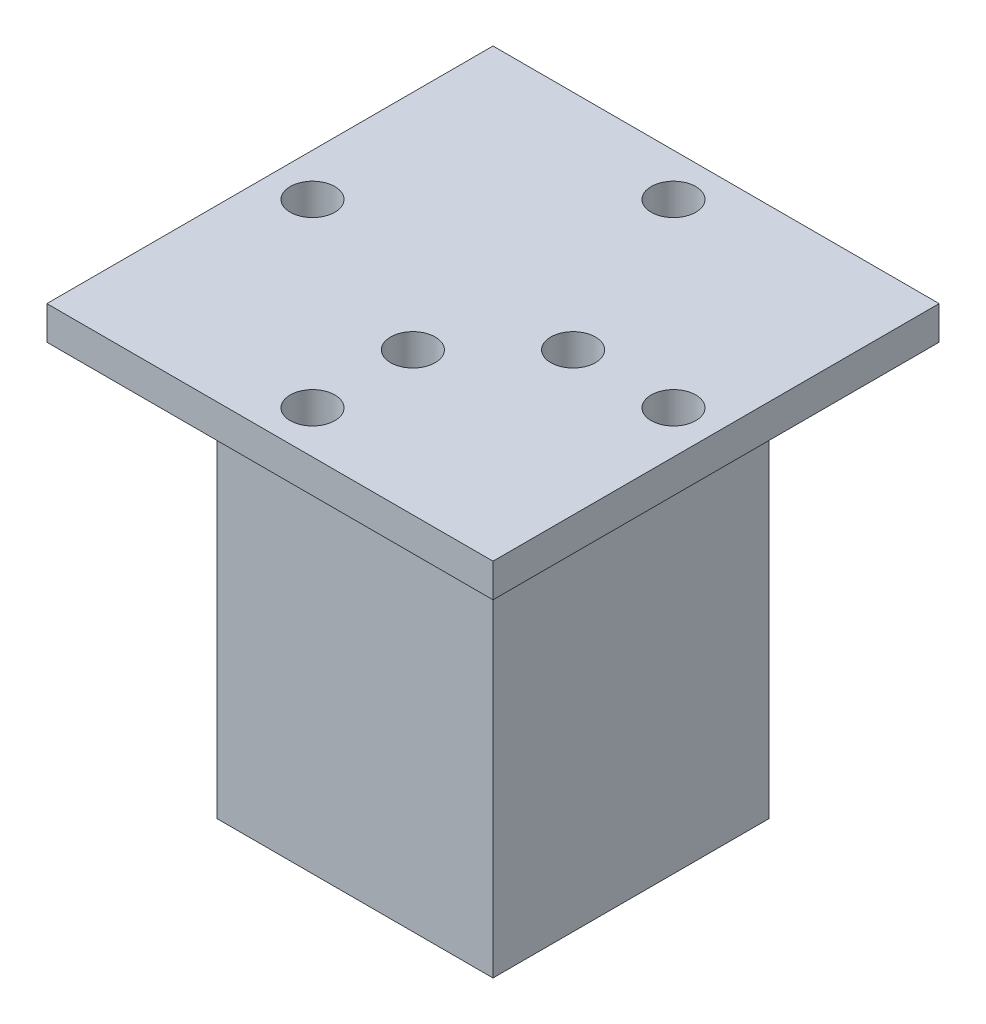
from build123d import *

# Parameters (mm, degrees)
SKETCH1_W                                      = 193.929
SKETCH1_H                                      = 117.602
BOSS_EXTRUDE1_DEPTH                            = 2.667
CUT_EXTRUDE1_DEPTH                             = 0.254
BOSS_EXTRUDE2_DEPTH                            = 0.254
BOSS_EXTRUDE3_DEPTH                            = 1.6002
BOSS_EXTRUDE4_DEPTH                            = 1.6002
BOSS_EXTRUDE5_DEPTH                            = 1.6002
BOSS_EXTRUDE6_DEPTH                            = 1.6002
BOSS_EXTRUDE7_DEPTH                            = 1.6002
SKETCH9_W                                      = 3.683
SKETCH9_H                                      = 3.175
SKETCH10_W                                     = 3.683
SKETCH10_H                                     = 3.175
SKETCH11_W                                     = 3.683
SKETCH11_H                                     = 3.175
SKETCH12_W                                     = 3.683
SKETCH12_H                                     = 3.175
CSK_FOR_M3_FLAT_HEAD_MACHINE_SCREW1_AT_2_COUNT = 2
CSK_FOR_M3_FLAT_HEAD_MACHINE_SCREW1_AT_2_PITCH = 202.702821766
CSK_FOR_M3_FLAT_HEAD_MACHINE_SCREW1_AT_3_COUNT = 2
CSK_FOR_M3_FLAT_HEAD_MACHINE_SCREW1_AT_3_PITCH = 176.276
CSK_FOR_M3_FLAT_HEAD_MACHINE_SCREW1_AT_4_COUNT = 2
CSK_FOR_M3_FLAT_HEAD_MACHINE_SCREW1_AT_4_PITCH = 100.076
FILLET1_R                                      = 5.1562
FILLET2_R                                      = 1.5748
FILLET3_R                                      = 3.9624
FILLET4_R                                      = 4.7498
SKETCH16_W                                     = 24.727732192
SKETCH16_H                                     = 24.727732192
BOSS_EXTRUDE8_DEPTH                            = 40
SKETCH18_W                                     = 40
SKETCH18_H                                     = 40
SKETCH18_W_2                                   = 24.727732192
SKETCH18_H_2                                   = 24.727732192
BOSS_EXTRUDE9_DEPTH                            = 3
CUT_EXTRUDE2_DEPTH                             = 40
CUT_EXTRUDE2_DEPTH_BACK                        = 40
SKETCH17_R                                     = 2
SKETCH19_R                                     = 2
CUT_EXTRUDE3_DEPTH                             = 10
SKETCH20_W                                     = 226.645594452
SKETCH20_H                                     = 139.264160446
SKETCH20_W_2                                   = 98.304113256
SKETCH20_H_2                                   = 70.390599616
CUT_EXTRUDE4_DEPTH                             = 121.248375711
SKETCH21_W                                     = 98.304113256
SKETCH21_H                                     = 2.667
CUT_EXTRUDE5_DEPTH                             = 100.458365049
SKETCH23_R                                     = 2
CUT_EXTRUDE6_DEPTH                             = 49.989794856


with BuildPart() as part:
    # Sketch1 → Boss-Extrude1 (new body)
    with BuildSketch(Plane.XZ.offset(2.667)):
        Rectangle(SKETCH1_W, SKETCH1_H)
    extrude(amount=-BOSS_EXTRUDE1_DEPTH)

    # Sketch2 → Cut-Extrude1 (cut)
    with BuildSketch(Plane.XZ.offset(2.667)):
        Polygon((-74.4728, 55.3085), (-93.472, 36.2712), (-93.472, -36.2712), (-74.4728, -55.3085), (74.4728, -55.3085), (93.472, -36.2712), (93.472, 36.2712), (74.4728, 55.3085), align=None)
    extrude(amount=-CUT_EXTRUDE1_DEPTH, mode=Mode.SUBTRACT)

    # Sketch3 → Boss-Extrude2 (add)
    with BuildSketch(Plane.XZ.offset(2.413)):
        Polygon((92.6846, 35.945510163), (92.6846, -35.945510163), (74.146186127, -54.5211), (-74.146186127, -54.5211), (-92.6846, -35.945510163), (-92.6846, 35.945510163), (-74.146186127, 54.5211), (74.146186127, 54.5211), align=None)
    extrude(amount=BOSS_EXTRUDE2_DEPTH)

    # Sketch4 → Boss-Extrude3 (add)
    with BuildSketch(Plane(origin=(0, 0, 0), x_dir=(-1, 0, 0), z_dir=(0, 1, 0))):
        with BuildLine():
            Line((92.6211, -49.3395), (92.6211, 49.3395))
            ThreePointArc((92.6211, 49.3395), (93.4212, 50.1396), (94.2213, 49.3395))
            Line((94.2213, 49.3395), (94.2213, -49.3395))
            ThreePointArc((94.2213, -49.3395), (93.4212, -50.1396), (92.6211, -49.3395))
        make_face()
    extrude(amount=BOSS_EXTRUDE3_DEPTH)

    # Sketch5 → Boss-Extrude4 (add)
    with BuildSketch(Plane(origin=(0, 0, 0), x_dir=(-1, 0, 0), z_dir=(0, 1, 0))):
        with BuildLine():
            Line((-94.2213, -49.3395), (-94.2213, 49.3395))
            ThreePointArc((-94.2213, 49.3395), (-93.4212, 50.1396), (-92.6211, 49.3395))
            Line((-92.6211, 49.3395), (-92.6211, -49.3395))
            ThreePointArc((-92.6211, -49.3395), (-93.4212, -50.1396), (-94.2213, -49.3395))
        make_face()
    extrude(amount=BOSS_EXTRUDE4_DEPTH)

    # Sketch6 → Boss-Extrude5 (add)
    with BuildSketch(Plane(origin=(0, 0, 0), x_dir=(-1, 0, 0), z_dir=(0, 1, 0))):
        with BuildLine():
            Line((10.4013, -54.4576), (87.5919, -54.4576))
            ThreePointArc((87.5919, -54.4576), (88.392, -55.2577), (87.5919, -56.0578))
            Line((87.5919, -56.0578), (10.4013, -56.0578))
            ThreePointArc((10.4013, -56.0578), (9.6012, -55.2577), (10.4013, -54.4576))
        make_face()
    extrude(amount=BOSS_EXTRUDE5_DEPTH)

    # Sketch7 → Boss-Extrude6 (add)
    with BuildSketch(Plane(origin=(0, 0, 0), x_dir=(-1, 0, 0), z_dir=(0, 1, 0))):
        with BuildLine():
            Line((-87.5919, 56.0578), (87.5919, 56.0578))
            ThreePointArc((87.5919, 56.0578), (88.392, 55.2577), (87.5919, 54.4576))
            Line((87.5919, 54.4576), (-87.5919, 54.4576))
            ThreePointArc((-87.5919, 54.4576), (-88.392, 55.2577), (-87.5919, 56.0578))
        make_face()
    extrude(amount=BOSS_EXTRUDE6_DEPTH)

    # Sketch8 → Boss-Extrude7 (add)
    with BuildSketch(Plane(origin=(0, 0, 0), x_dir=(-1, 0, 0), z_dir=(0, 1, 0))):
        with BuildLine():
            Line((-87.5919, -54.4576), (-10.4013, -54.4576))
            ThreePointArc((-10.4013, -54.4576), (-9.6012, -55.2577), (-10.4013, -56.0578))
            Line((-10.4013, -56.0578), (-87.5919, -56.0578))
            ThreePointArc((-87.5919, -56.0578), (-88.392, -55.2577), (-87.5919, -54.4576))
        make_face()
    extrude(amount=BOSS_EXTRUDE7_DEPTH)

    # Sketch9 → Revolve1 (revolve)
    with BuildSketch(Plane.XY.offset(-50.038), mode=Mode.PRIVATE) as revolve1_sk:
        with Locations((-86.2965, 1.5875)):
            Rectangle(SKETCH9_W, SKETCH9_H)
    revolve(revolve1_sk.sketch.rotate(Axis((-88.138, 3.175, -50.038), (0, -1, 0)), 270), axis=Axis((-88.138, 3.175, -50.038), (0, -1, 0)))

    # Sketch10 → Revolve2 (revolve)
    with BuildSketch(Plane.XY.offset(50.038), mode=Mode.PRIVATE) as revolve2_sk:
        with Locations((89.9795, 1.5875)):
            Rectangle(SKETCH10_W, SKETCH10_H)
    revolve(revolve2_sk.sketch.rotate(Axis((88.138, 3.175, 50.038), (0, -1, 0)), 270), axis=Axis((88.138, 3.175, 50.038), (0, -1, 0)))

    # Sketch11 → Revolve3 (revolve)
    with BuildSketch(Plane.XY.offset(50.038), mode=Mode.PRIVATE) as revolve3_sk:
        with Locations((-86.2965, 1.5875)):
            Rectangle(SKETCH11_W, SKETCH11_H)
    revolve(revolve3_sk.sketch.rotate(Axis((-88.138, 3.175, 50.038), (0, -1, 0)), 270), axis=Axis((-88.138, 3.175, 50.038), (0, -1, 0)))

    # Sketch12 → Revolve4 (revolve)
    with BuildSketch(Plane.XY.offset(-50.038), mode=Mode.PRIVATE) as revolve4_sk:
        with Locations((89.9795, 1.5875)):
            Rectangle(SKETCH12_W, SKETCH12_H)
    revolve(revolve4_sk.sketch.rotate(Axis((88.138, 3.175, -50.038), (0, -1, 0)), 270), axis=Axis((88.138, 3.175, -50.038), (0, -1, 0)))

    # Sketch13 → CSK for M3 Flat Head Machine Screw1 (revolve, cut)
    with BuildSketch(Plane(origin=(88.138, -2.667, -50.038), x_dir=(0, 0, -1), z_dir=(1, 0, 0))):
        Polygon((0, 0), (0, 5.842), (1.6256, 5.842), (1.6256, 3.175), (3.048, 1.538715978), (3.048, 0), align=None)
    csk_for_m3_flat_head_machine_screw1 = revolve(axis=Axis((88.138, -9.017, -50.038), (0, 1, 0)), mode=Mode.SUBTRACT)

    # CSK for M3 Flat Head Machine Screw1 at 2: CSK for M3 Flat Head Machine Screw1 ×2
    with Locations(*[Vector(-0.8696277558645717, 0, 0.4937079766723937) * (i * CSK_FOR_M3_FLAT_HEAD_MACHINE_SCREW1_AT_2_PITCH) for i in range(1, CSK_FOR_M3_FLAT_HEAD_MACHINE_SCREW1_AT_2_COUNT)]):
        add(csk_for_m3_flat_head_machine_screw1, mode=Mode.SUBTRACT)

    # CSK for M3 Flat Head Machine Screw1 at 3: CSK for M3 Flat Head Machine Screw1 ×2
    with Locations(*[(-i * CSK_FOR_M3_FLAT_HEAD_MACHINE_SCREW1_AT_3_PITCH, 0, 0) for i in range(1, CSK_FOR_M3_FLAT_HEAD_MACHINE_SCREW1_AT_3_COUNT)]):
        add(csk_for_m3_flat_head_machine_screw1, mode=Mode.SUBTRACT)

    # CSK for M3 Flat Head Machine Screw1 at 4: CSK for M3 Flat Head Machine Screw1 ×2
    with Locations(*[(0, 0, i * CSK_FOR_M3_FLAT_HEAD_MACHINE_SCREW1_AT_4_PITCH) for i in range(1, CSK_FOR_M3_FLAT_HEAD_MACHINE_SCREW1_AT_4_COUNT)]):
        add(csk_for_m3_flat_head_machine_screw1, mode=Mode.SUBTRACT)

    # Fillet1
    fillet1_edges = [part.edges().sort_by_distance(p)[0] for p in [
        (-96.9645, -1.3335, 58.801),
        (96.9645, -1.3335, 58.801),
        (96.9645, -1.3335, -58.801),
        (-96.9645, -1.3335, -58.801),
    ]]
    fillet(fillet1_edges, radius=FILLET1_R)

    # Fillet2
    fillet2_edges = [part.edges().sort_by_distance(p)[0] for p in [
        (0, -2.667, 58.801),
        (-96.9645, -2.667, 0),
        (0, -2.667, -58.801),
        (96.9645, -2.667, 0),
        (95.454283985, -2.667, -57.290783985),
        (95.454283985, -2.667, 57.290783985),
        (-95.454283985, -2.667, -57.290783985),
        (-95.454283985, -2.667, 57.290783985),
    ]]
    fillet(fillet2_edges, radius=FILLET2_R)

    # Fillet3
    fillet3_edges = [part.edges().sort_by_distance(p)[0] for p in [
        (92.6846, -2.54, 35.945510163),
        (74.146186127, -2.54, 54.5211),
        (-74.146186127, -2.54, 54.5211),
        (-92.6846, -2.54, 35.945510163),
        (-92.6846, -2.54, -35.945510163),
        (-74.146186127, -2.54, -54.5211),
        (74.146186127, -2.54, -54.5211),
        (92.6846, -2.54, -35.945510163),
    ]]
    fillet(fillet3_edges, radius=FILLET3_R)

    # Fillet4
    fillet4_edges = [part.edges().sort_by_distance(p)[0] for p in [
        (-74.4728, -2.54, 55.3085),
        (74.4728, -2.54, 55.3085),
        (93.472, -2.54, 36.2712),
        (93.472, -2.54, -36.2712),
        (74.4728, -2.54, -55.3085),
        (-74.4728, -2.54, -55.3085),
        (-93.472, -2.54, -36.2712),
        (-93.472, -2.54, 36.2712),
    ]]
    fillet(fillet4_edges, radius=FILLET4_R)

    # Sketch16 → Boss-Extrude8 (add)
    with BuildSketch(Plane.XZ.offset(2.667)):
        Rectangle(SKETCH16_W, SKETCH16_H)
    extrude(amount=BOSS_EXTRUDE8_DEPTH)

    # Sketch18 → Boss-Extrude9 (add)
    with BuildSketch(Plane.XZ.offset(2.667)):
        Rectangle(SKETCH18_W, SKETCH18_H)
        Rectangle(SKETCH18_W_2, SKETCH18_H_2, mode=Mode.SUBTRACT)
    extrude(amount=BOSS_EXTRUDE9_DEPTH)

    # Sketch17 → Cut-Extrude2 (cut, two sides: drawn at the far end of the back side and taken through both)
    with BuildSketch(Plane.XZ.offset(2.667).offset(-CUT_EXTRUDE2_DEPTH_BACK)):
        with Locations(Location((-16.181933048, 0, 0), (0, 0, 270))):
            Circle(SKETCH17_R)
        with Locations(Location((0, 16.181933048, 0), (0, 0, 270))):
            Circle(SKETCH17_R)
        with Locations(Location((16.181933048, 0, 0), (0, 0, 270))):
            Circle(SKETCH17_R)
        with Locations(Location((0, -16.181933048, 0), (0, 0, 270))):
            Circle(SKETCH17_R)
    extrude(amount=CUT_EXTRUDE2_DEPTH + CUT_EXTRUDE2_DEPTH_BACK, mode=Mode.SUBTRACT)

    # Sketch19 → Cut-Extrude3 (cut)
    with BuildSketch(Plane.XZ.offset(42.667)):
        with Locations(Location((0, 0, 0), (0, 0, 270))):
            Circle(SKETCH19_R)
    extrude(amount=-CUT_EXTRUDE3_DEPTH, mode=Mode.SUBTRACT)

    # Sketch20 → Cut-Extrude4 (cut, through all)
    with BuildSketch(Plane.XZ.offset(2.667)):
        with Locations((4.399412476, -0.910223271)):
            Rectangle(SKETCH20_W, SKETCH20_H)
        with Locations((-6.674970653, -1.97215042)):
            Rectangle(SKETCH20_W_2, SKETCH20_H_2, mode=Mode.SUBTRACT)
    extrude(amount=-CUT_EXTRUDE4_DEPTH, mode=Mode.SUBTRACT)

    # Sketch21 → Cut-Extrude5 (cut, through all)
    with BuildSketch(Plane(origin=(0, 0, -37.167450228), x_dir=(-1, 0, 0), z_dir=(0, 0, -1))):
        with Locations((6.674970653, -1.3335)):
            Rectangle(SKETCH21_W, SKETCH21_H)
    extrude(amount=-CUT_EXTRUDE5_DEPTH, mode=Mode.SUBTRACT)

    # Sketch23 → Cut-Extrude6 (cut, through all)
    with BuildSketch(Plane.XZ.offset(42.667)):
        with Locations(Location((7.181933048, 0, 0), (0, 0, 270))):
            Circle(SKETCH23_R)
        with Locations(Location((0, 7.181933048, 0), (0, 0, 90))):
            Circle(SKETCH23_R)
    extrude(amount=-CUT_EXTRUDE6_DEPTH, mode=Mode.SUBTRACT)


solid = part.part
